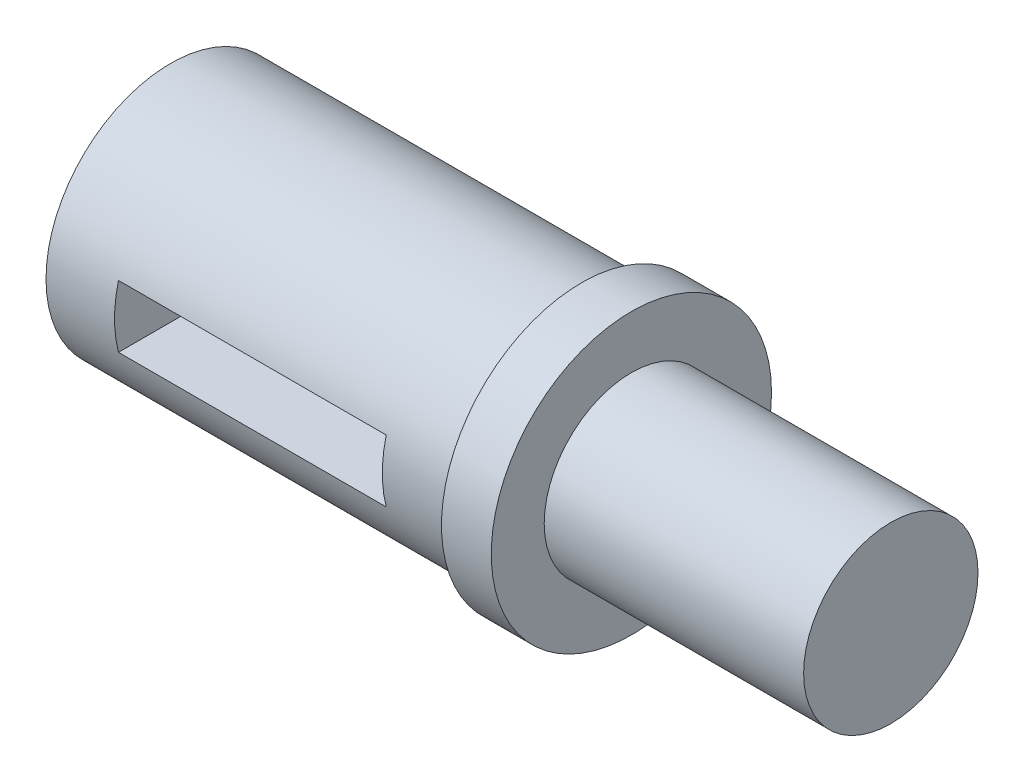
from build123d import *

# Parameters (mm, degrees)
CUT_EXTRUDE1_DEPTH      = 69.066884873
CUT_EXTRUDE1_DEPTH_BACK = 69.066884873
SKETCH2_W               = 43
SKETCH2_H               = 10


with BuildPart() as part:
    # Sketch1 → Revolve1 (revolve)
    with BuildSketch(Plane(origin=(0, 0, 0), x_dir=(1, 0, 0), z_dir=(0, 1, 0))):
        Polygon((-55.485714286, 0), (-55.485714286, 20), (10.514285714, 20), (10.514285714, 22.5), (18.514285714, 22.5), (18.514285714, 14), (60.171428571, 14), (60.171428571, 0), align=None)
    revolve(axis=Axis((60.171428571, 0, 0), (-1, 0, 0)))

    # Sketch2 → Cut-Extrude1 (cut, two sides: drawn at the far end of the back side and taken through both)
    with BuildSketch(Plane.XY.offset(-CUT_EXTRUDE1_DEPTH_BACK)):
        with Locations((-22.985714286, 0)):
            Rectangle(SKETCH2_W, SKETCH2_H)
    extrude(amount=CUT_EXTRUDE1_DEPTH + CUT_EXTRUDE1_DEPTH_BACK, mode=Mode.SUBTRACT)


solid = part.part
